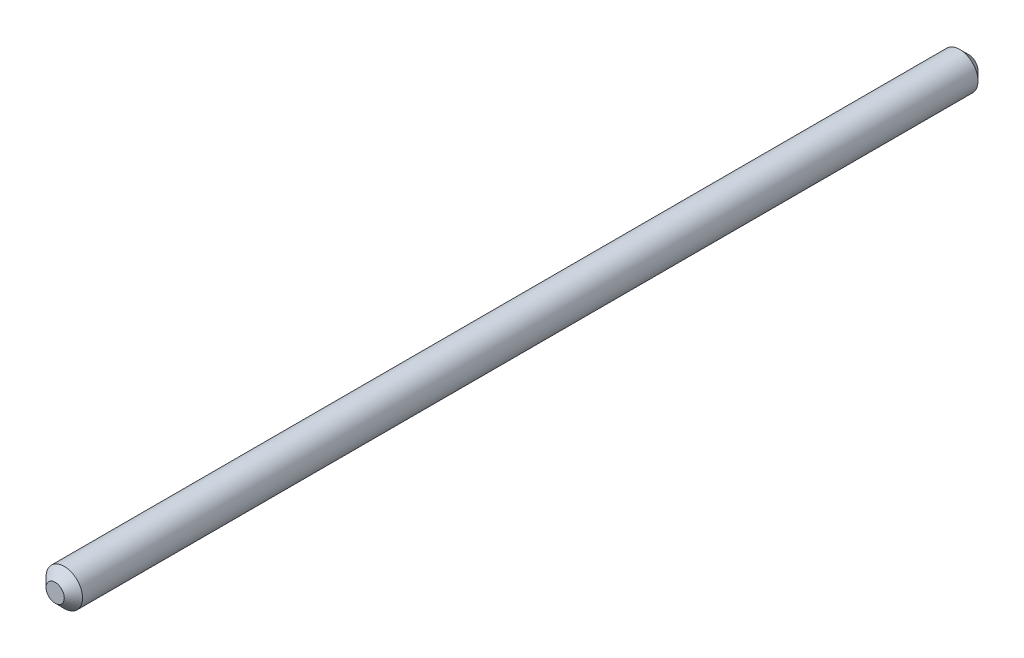
from build123d import *

# Parameters (mm, degrees)
SKETCH1_R           = 1
BOSS_EXTRUDE1_DEPTH = 50
CHAMFER1_SIZE       = 0.5


with BuildPart() as part:
    # Sketch1 → Boss-Extrude1 (new body)
    with BuildSketch(Plane.XY):
        Circle(SKETCH1_R)
    extrude(amount=BOSS_EXTRUDE1_DEPTH)

    # Chamfer1
    chamfer1_edges = [part.edges().sort_by_distance(p)[0] for p in [
        (-1, 0, 0),
        (-1, 0, 50),
    ]]
    chamfer(chamfer1_edges, length=CHAMFER1_SIZE)


solid = part.part
